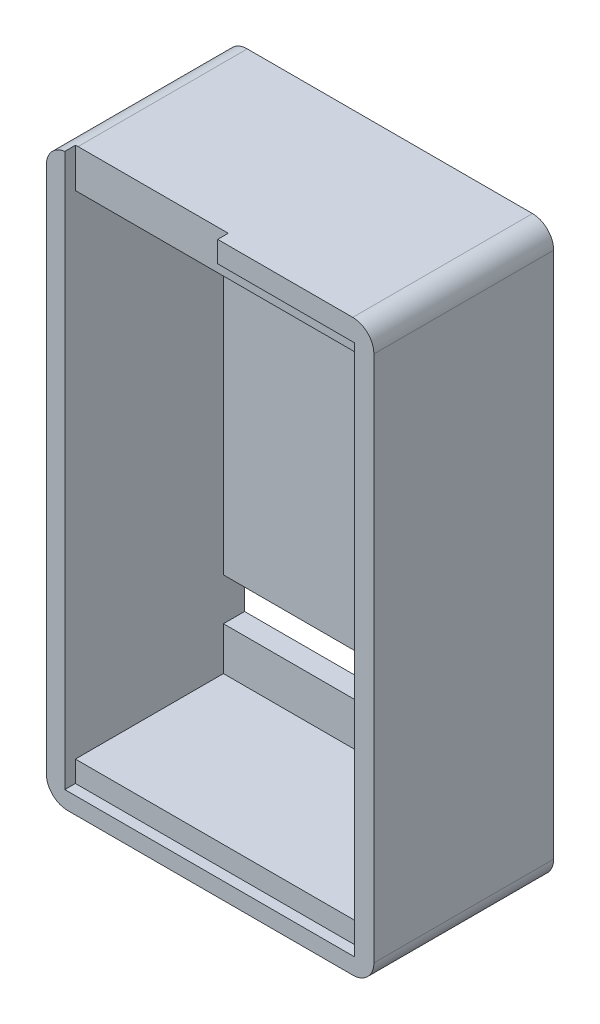
from build123d import *

# Parameters (mm, degrees)
SKETCH_3_W          = 30.974653289306993
SKETCH_3_H          = 53.86877740136471
EXTRUDE_1_DEPTH     = 17
SKETCH_5_W          = 27.381586342504548
SKETCH_5_H          = 50.55917117672057
CUT_EXTRUDE_1_DEPTH = 15
SKETCH_6_W          = 27.381586342504548
SKETCH_6_H          = 2
EXTRUDE_2_DEPTH     = 14
SKETCH_9_W          = 27.3909573875588
SKETCH_9_H          = 1.7284906083583529
CUT_EXTRUDE_3_DEPTH = 1
SKETCH_10_W         = 12.935202359823364
SKETCH_10_H         = 2.000000000000007
EXTRUDE_4_DEPTH     = 1
FILLET_1_R          = 2
SKETCH_11_W         = 27.381586342504548
SKETCH_11_H         = 4
CUT_EXTRUDE_4_DEPTH = 10


with BuildPart() as part:
    # 草图3 → 凸台-拉伸1 (new body)
    with BuildSketch(Plane.XY):
        with Locations((52.15403343225914, -51.822040042061936)):
            Rectangle(SKETCH_3_W, SKETCH_3_H)
    extrude(amount=EXTRUDE_1_DEPTH)

    # 草图5 → 切除-拉伸1 (cut)
    with BuildSketch(Plane.XY.offset(17)):
        with Locations((52.10467994598998, -51.89572753809822)):
            Rectangle(SKETCH_5_W, SKETCH_5_H)
    extrude(amount=-CUT_EXTRUDE_1_DEPTH, mode=Mode.SUBTRACT)

    # 草图6 → 凸台-拉伸2 (add)
    with BuildSketch(Plane.XY.offset(2.0000000000000018)):
        with Locations((52.10467994598998, -27.616141949737933)):
            Rectangle(SKETCH_6_W, SKETCH_6_H)
        with Locations((52.10467994598998, -76.1753131264585)):
            Rectangle(SKETCH_6_W, SKETCH_6_H)
    extrude(amount=EXTRUDE_2_DEPTH)

    # 草图9 → 切除-拉伸3 (cut)
    with BuildSketch(Plane.XY.offset(17)):
        with Locations((52.109365468517105, -25.75189664555876)):
            Rectangle(SKETCH_9_W, SKETCH_9_H)
    extrude(amount=-CUT_EXTRUDE_3_DEPTH, mode=Mode.SUBTRACT)

    # 草图10 → 凸台-拉伸4 (add)
    with BuildSketch(Plane.XY.offset(16)):
        with Locations((59.33724298238482, -25.887651341379584)):
            Rectangle(SKETCH_10_W, SKETCH_10_H)
    extrude(amount=EXTRUDE_4_DEPTH)

    # 圆角1
    fillet_1_edges = [part.edges().sort_by_distance(p)[0] for p in [
        (67.64136007691263, -78.75642874274429, 8.5),
        (36.66670678760564, -78.75642874274429, 8.5),
        (36.66670678760564, -24.88765134137958, 8.5),
        (67.64136007691263, -24.88765134137958, 8.5),
    ]]
    fillet(fillet_1_edges, radius=FILLET_1_R)

    # 草图11 → 切除-拉伸4 (cut)
    with BuildSketch(Plane.XY.offset(2.0000000000000018)):
        with Locations((52.10467994598998, -34.82711454905556)):
            Rectangle(SKETCH_11_W, SKETCH_11_H)
        with Locations((52.10467994598998, -69.09032852544172)):
            Rectangle(SKETCH_11_W, SKETCH_11_H)
    extrude(amount=-CUT_EXTRUDE_4_DEPTH, mode=Mode.SUBTRACT)


solid = part.part
